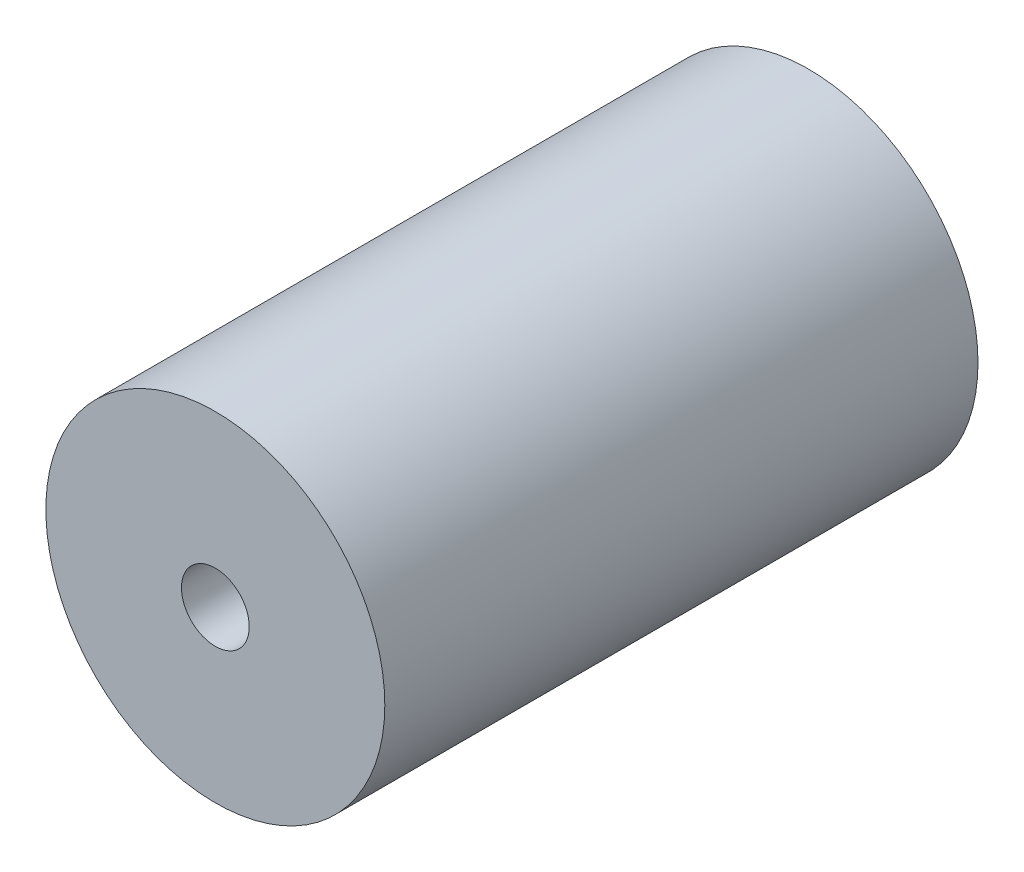
from build123d import *

# Parameters (mm, degrees)
SKETCH_2_R      = 10
SKETCH_2_R_2    = 2
EXTRUDE_1_DEPTH = 35


with BuildPart() as part:
    # Эскиз2 → Бобышка-Вытянуть1 (new body)
    with BuildSketch(Plane.XY):
        Circle(SKETCH_2_R)
        Circle(SKETCH_2_R_2, mode=Mode.SUBTRACT)
    extrude(amount=EXTRUDE_1_DEPTH)


solid = part.part
